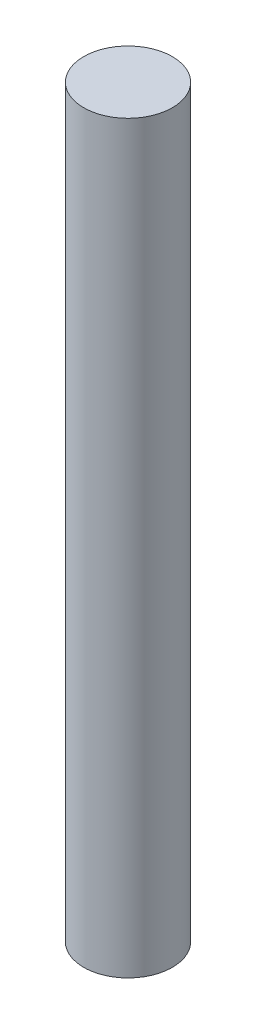
from build123d import *

# Parameters (mm, degrees)
SKETCH1_R           = 5
BOSS_EXTRUDE1_DEPTH = 84


with BuildPart() as part:
    # Sketch1 → Boss-Extrude1 (new body)
    with BuildSketch(Plane(origin=(0, 0, 0), x_dir=(1, 0, 0), z_dir=(0, 1, 0))):
        with Locations(Location((0, 0, 0), (0, 0, 90))):
            Circle(SKETCH1_R)
    extrude(amount=BOSS_EXTRUDE1_DEPTH)


solid = part.part
